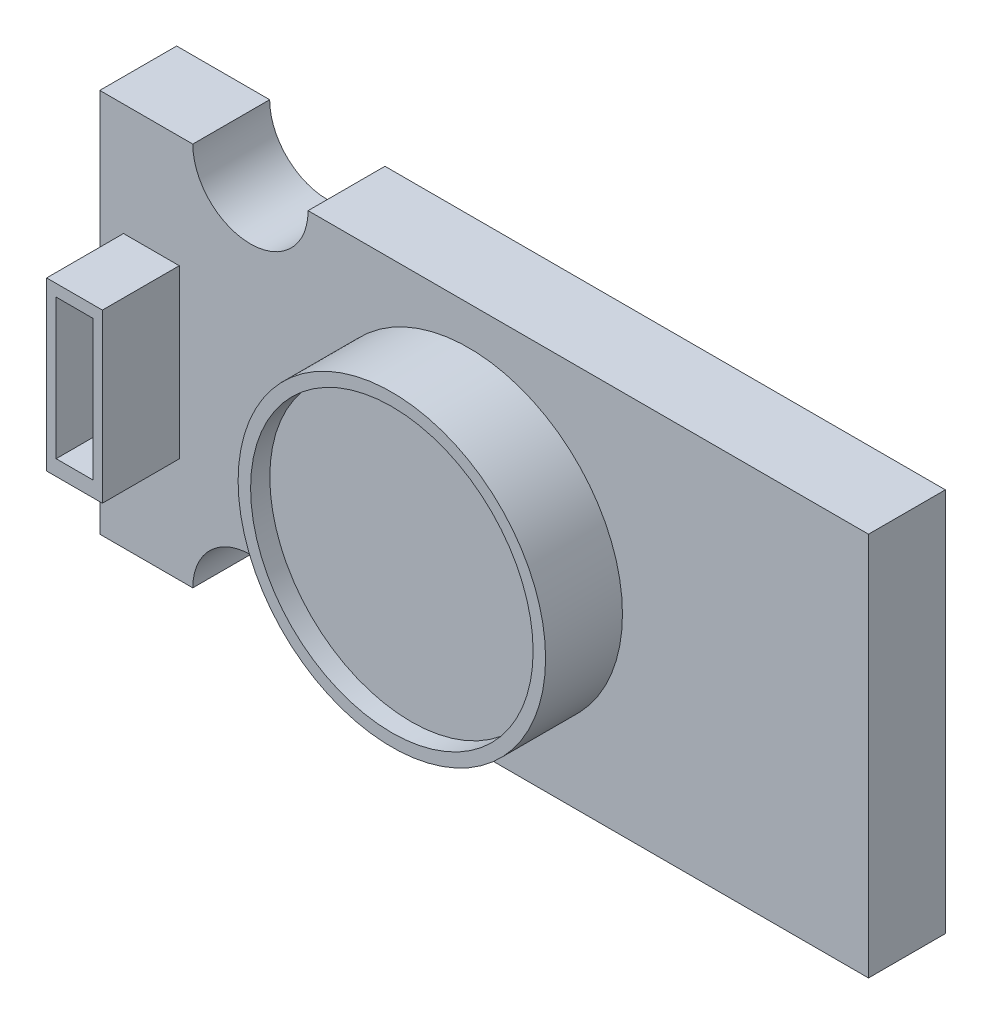
from build123d import *

# Parameters (mm, degrees)
ESQUISSE1_W             = 20
ESQUISSE1_H             = 10
BOSS_EXTRU_1_DEPTH      = 2
ESQUISSE2_R             = 1.5
ENL_V_MAT_EXTRU_1_DEPTH = 2
ESQUISSE3_R             = 4
BOSS_EXTRU_2_DEPTH      = 2
ESQUISSE4_R             = 3.675436607
ENL_V_MAT_EXTRU_2_DEPTH = 0.5
ESQUISSE5_W             = 1.450639668
ESQUISSE5_H             = 4.351919005
BOSS_EXTRU_3_DEPTH      = 2
ESQUISSE6_W             = 0.956804888
ESQUISSE6_H             = 3.642031508
ENL_V_MAT_EXTRU_3_DEPTH = 1.5


with BuildPart() as part:
    # Esquisse1 → Boss.-Extru.1 (new body)
    with BuildSketch(Plane.XY):
        with Locations((1.582964004, 3.620689655)):
            Rectangle(ESQUISSE1_W, ESQUISSE1_H)
    extrude(amount=BOSS_EXTRU_1_DEPTH)

    # Esquisse2 → Enlèv. mat.-Extru.1 (cut)
    with BuildSketch(Plane.XY.offset(2)):
        with Locations((-4.497376734, 8.620689655)):
            Circle(ESQUISSE2_R)
        with Locations((-4.497376734, -1.379310345)):
            Circle(ESQUISSE2_R)
    extrude(amount=-ENL_V_MAT_EXTRU_1_DEPTH, mode=Mode.SUBTRACT)

    # Esquisse3 → Boss.-Extru.2 (add)
    with BuildSketch(Plane.XY.offset(2)):
        with Locations((1.181723245, 3.620689655)):
            Circle(ESQUISSE3_R)
    extrude(amount=BOSS_EXTRU_2_DEPTH)

    # Esquisse4 → Enlèv. mat.-Extru.2 (cut)
    with BuildSketch(Plane.XY.offset(4)):
        with Locations((1.181723245, 3.620689655)):
            Circle(ESQUISSE4_R)
    extrude(amount=-ENL_V_MAT_EXTRU_2_DEPTH, mode=Mode.SUBTRACT)

    # Esquisse5 → Boss.-Extru.3 (add)
    with BuildSketch(Plane.XY.offset(2)):
        with Locations((-7.074576996, 3.528095633)):
            Rectangle(ESQUISSE5_W, ESQUISSE5_H)
    extrude(amount=BOSS_EXTRU_3_DEPTH)

    # Esquisse6 → Enlèv. mat.-Extru.3 (cut)
    with BuildSketch(Plane.XY.offset(4)):
        with Locations((-7.074576996, 3.574392644)):
            Rectangle(ESQUISSE6_W, ESQUISSE6_H)
    extrude(amount=-ENL_V_MAT_EXTRU_3_DEPTH, mode=Mode.SUBTRACT)


solid = part.part
